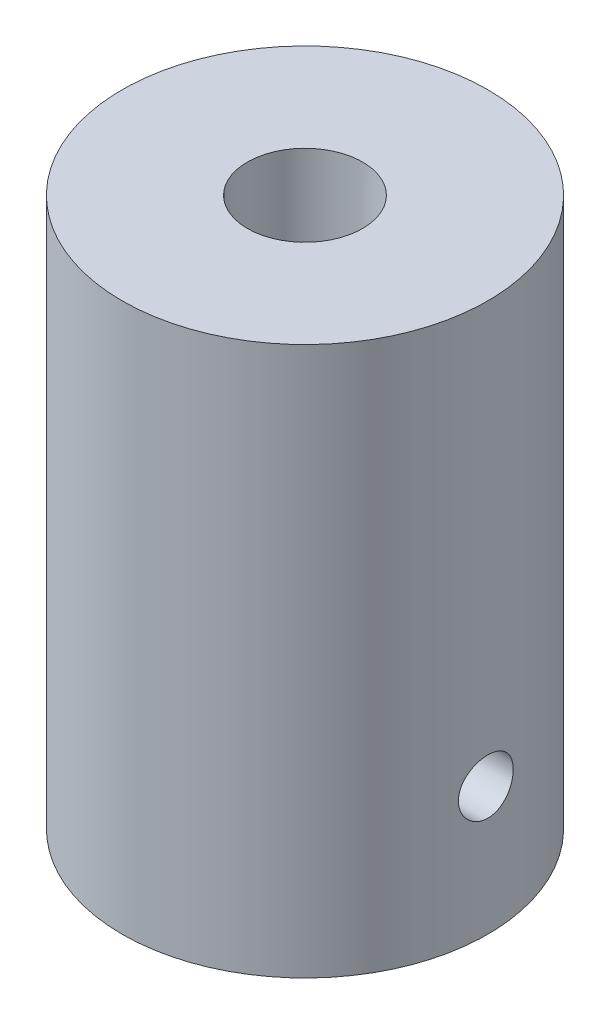
from build123d import *

# Parameters (mm, degrees)
SKETCH_1_R               = 10
SKETCH_1_R_2             = 3.15
EXTRUDE_1_DEPTH          = 30
CUT_EXTRUDE_1_DEPTH      = 34.166247904
CUT_EXTRUDE_1_DEPTH_BACK = 34.166247904
SKETCH_2_R               = 1.5
SKETCH_3_R               = 1.5
CUT_EXTRUDE_2_DEPTH      = 34.166248063
SKETCH_4_R               = 6.15
CUT_EXTRUDE_3_DEPTH      = 18
CUT_EXTRUDE_START        = -10
SKETCH_5_R               = 3
CUT_EXTRUDE_4_DEPTH      = 3


with BuildPart() as part:
    # 草图1 → 凸台-拉伸1 (new body)
    with BuildSketch(Plane(origin=(0, 0, 0), x_dir=(1, 0, 0), z_dir=(0, 1, 0))):
        with Locations(Location((0, 0, 0), (0, 0, 270))):
            Circle(SKETCH_1_R)
        with Locations(Location((0, 0, 0), (0, 0, 270))):
            Circle(SKETCH_1_R_2, mode=Mode.SUBTRACT)
    extrude(amount=EXTRUDE_1_DEPTH)

    # 草图2 → 切除-拉伸1 (cut, two sides: drawn at the far end of the back side and taken through both)
    with BuildSketch(Plane(origin=(0, 0, 0), x_dir=(0, 0, -1), z_dir=(1, 0, 0)).offset(-CUT_EXTRUDE_1_DEPTH_BACK)):
        with Locations((0, 7)):
            Circle(SKETCH_2_R)
    extrude(amount=CUT_EXTRUDE_1_DEPTH + CUT_EXTRUDE_1_DEPTH_BACK, mode=Mode.SUBTRACT)

    # 草图3 → 切除-拉伸2 (cut, through all)
    with BuildSketch(Plane.XY):
        with Locations(Location((0, 24, 0), (0, 0, 90))):
            Circle(SKETCH_3_R)
    extrude(amount=-CUT_EXTRUDE_2_DEPTH, mode=Mode.SUBTRACT)

    # 草图4 → 切除-拉伸3 (cut)
    with BuildSketch(Plane.XZ):
        with Locations(Location((0, 0, 0), (0, 0, 270))):
            Circle(SKETCH_4_R)
    extrude(amount=-CUT_EXTRUDE_3_DEPTH, mode=Mode.SUBTRACT)

    # 草图5 → 切除-拉伸4 (cut)
    with BuildSketch(Plane.XY.offset(CUT_EXTRUDE_START)):
        with Locations(Location((0, 24, 0), (0, 0, 90))):
            Circle(SKETCH_5_R)
    extrude(amount=CUT_EXTRUDE_4_DEPTH, mode=Mode.SUBTRACT)


solid = part.part
